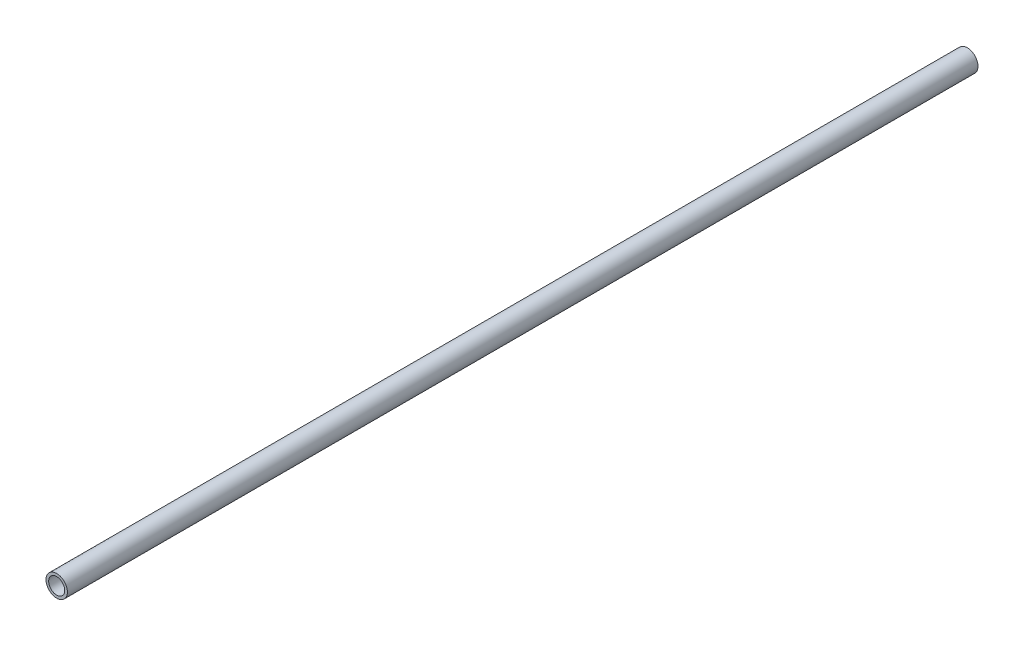
from build123d import *

# Parameters (mm, degrees)
SKETCH_1_R      = 4
SKETCH_1_R_2    = 3
EXTRUDE_1_DEPTH = 340


with BuildPart() as part:
    # 草图1 → 凸台-拉伸1 (new body)
    with BuildSketch(Plane.XY):
        Circle(SKETCH_1_R)
        Circle(SKETCH_1_R_2, mode=Mode.SUBTRACT)
    extrude(amount=EXTRUDE_1_DEPTH)


solid = part.part
